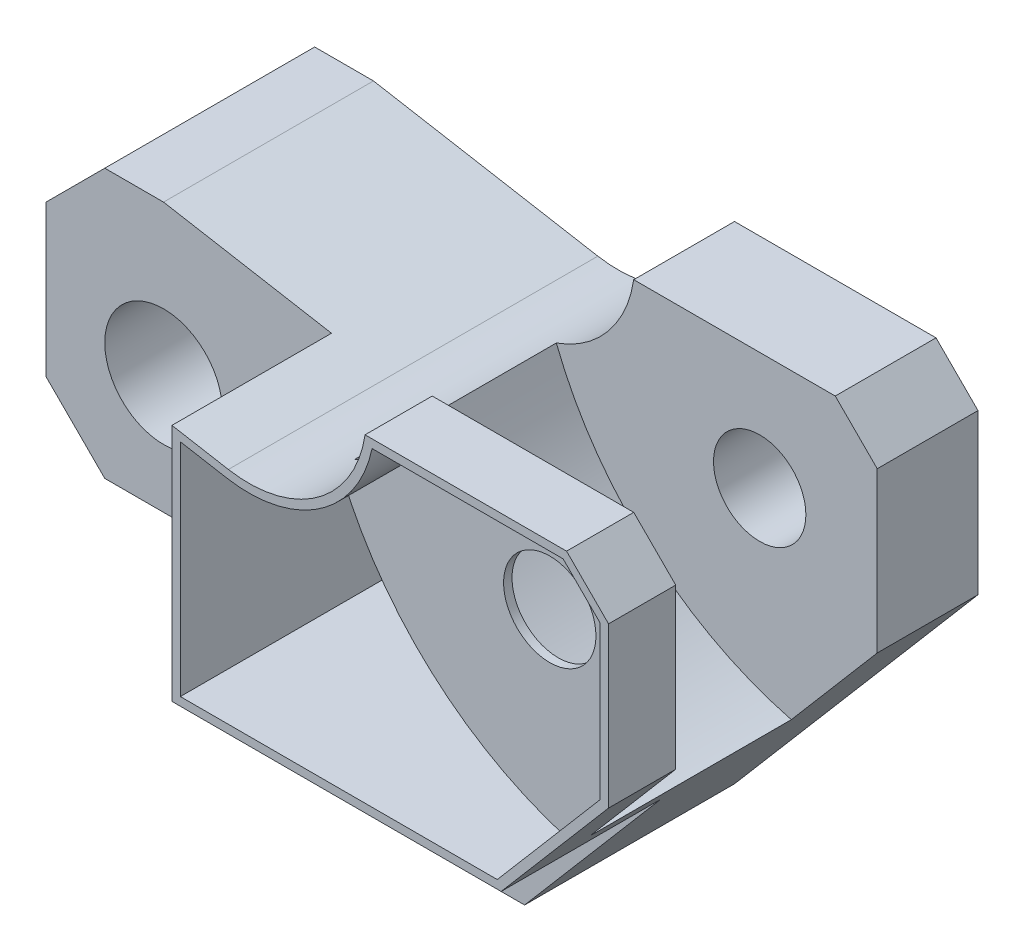
from build123d import *

# Parameters (mm, degrees)
SKETCH1_R           = 7
BOSS_EXTRUDE1_DEPTH = 44
SKETCH2_R           = 5.5
CUT_EXTRUDE1_DEPTH  = 99.636339936
CUT_EXTRUDE2_START  = -19
CUT_EXTRUDE2_DEPTH  = 19
CUT_EXTRUDE3_DEPTH  = 24
CUT_EXTRUDE4_DEPTH  = 7
CUT_EXTRUDE5_DEPTH  = 25


with BuildPart() as part:
    # Sketch1 → Boss-Extrude1 (new body)
    with BuildSketch(Plane.XY):
        with BuildLine():
            ThreePointArc((-40.404910175, -1.633500031), (-37.139674394, -2.846913799), (-35.459271434, -5.898205914))
            ThreePointArc((-35.459271434, -5.898205914), (-33.122441231, -13.749172092), (-28.683469034, -20.633500031))
            Line((-28.683469034, -20.633500031), (-22.980449087, -20.633500031))
            Line((-22.980449087, -20.633500031), (6.019550913, 13.366499969))
            Line((6.019550913, 13.366499969), (6.019550913, 32.366499969))
            Line((6.019550913, 32.366499969), (1.019550913, 37.366499969))
            Line((1.019550913, 37.366499969), (-22.980449087, 37.366499969))
            ThreePointArc((-22.980449087, 37.366499969), (-28.648710625, 28.077944899), (-39.256864445, 25.654410975))
            Line((-39.256864445, 25.654410975), (-65.980449087, 30.366499969))
            Line((-65.980449087, 30.366499969), (-72.980449087, 30.366499969))
            Line((-72.980449087, 30.366499969), (-79.980449087, 23.366499969))
            Line((-79.980449087, 23.366499969), (-79.980449087, 5.366499969))
            Line((-79.980449087, 5.366499969), (-72.980449087, -1.633500031))
            Line((-72.980449087, -1.633500031), (-40.404910175, -1.633500031))
        make_face()
        with Locations((-65.980449087, 12.366499969)):
            Circle(SKETCH1_R, mode=Mode.SUBTRACT)
    extrude(amount=BOSS_EXTRUDE1_DEPTH)

    # Sketch2 → Cut-Extrude1 (cut, through all)
    with BuildSketch(Plane.XY.offset(44)):
        with Locations((-7.980449087, 23.366499969)):
            Circle(SKETCH2_R)
    extrude(amount=-CUT_EXTRUDE1_DEPTH, mode=Mode.SUBTRACT)

    # Sketch3 → Cut-Extrude2 (cut)
    with BuildSketch(Plane.XY.offset(44).offset(CUT_EXTRUDE2_START)):
        Polygon((-45.980449087, 26.839960355), (-45.980449087, -1.633500031), (-72.980449087, -1.633500031), (-79.980449087, 5.366499969), (-79.980449087, 23.366499969), (-72.980449087, 30.366499969), (-65.980449087, 30.366499969), align=None)
        with BuildLine():
            Line((-40.404910175, -1.633500031), (-6.774566734, -1.633500031))
            Line((-6.774566734, -1.633500031), (-22.980449087, -20.633500031))
            Line((-22.980449087, -20.633500031), (-28.683469034, -20.633500031))
            ThreePointArc((-28.683469034, -20.633500031), (-33.122441231, -13.749172092), (-35.459271434, -5.898205914))
            ThreePointArc((-35.459271434, -5.898205914), (-37.139674394, -2.846913799), (-40.404910175, -1.633500031))
        make_face()
    extrude(amount=CUT_EXTRUDE2_DEPTH, mode=Mode.SUBTRACT)

    # Sketch7 → Cut-Extrude3 (cut)
    with BuildSketch(Plane(origin=(0, 0, 12), x_dir=(-1, 0, 0), z_dir=(0, 0, -1))):
        with BuildLine():
            Line((-6.019550913, 13.366499969), (4.215743204, 1.366499969))
            ThreePointArc((4.215743204, 1.366499969), (21.210918642, 10.417084234), (32.200340902, 26.227892629))
            ThreePointArc((32.200340902, 26.227892629), (26.041094158, 30.514775107), (22.980449087, 37.366499969))
            Line((22.980449087, 37.366499969), (-1.019550913, 37.366499969))
            Line((-1.019550913, 37.366499969), (-6.019550913, 32.366499969))
            Line((-6.019550913, 32.366499969), (-6.019550913, 13.366499969))
        make_face()
    extrude(amount=-CUT_EXTRUDE3_DEPTH, mode=Mode.SUBTRACT)

    # Sketch8 → Cut-Extrude4 (cut)
    with BuildSketch(Plane.XY.offset(44)):
        with BuildLine():
            Line((-44.980449087, 25.648206762), (-44.980449087, -0.633500031))
            Line((-44.980449087, -0.633500031), (-7.235972791, -0.633500031))
            Line((-7.235972791, -0.633500031), (5.019550913, 13.735045001))
            Line((5.019550913, 13.735045001), (5.019550913, 31.952286406))
            Line((5.019550913, 31.952286406), (0.605337351, 36.366499969))
            Line((0.605337351, 36.366499969), (-22.144406347, 36.366499969))
            ThreePointArc((-22.144406347, 36.366499969), (-28.419495692, 27.018587194), (-39.430512622, 24.669603222))
            Line((-39.430512622, 24.669603222), (-44.980449087, 25.648206762))
        make_face()
    extrude(amount=-CUT_EXTRUDE4_DEPTH, mode=Mode.SUBTRACT)

    # Sketch12 → Cut-Extrude5 (cut)
    with BuildSketch(Plane.XY.offset(37)):
        with BuildLine():
            Line((-7.235972791, -0.633500031), (-5.99360134, 0.823073394))
            ThreePointArc((-5.99360134, 0.823073394), (-22.117044704, 9.886135078), (-32.783766787, 24.996580242))
            ThreePointArc((-32.783766787, 24.996580242), (-36.088777964, 24.459836681), (-39.430512622, 24.669603222))
            Line((-39.430512622, 24.669603222), (-44.980449087, 25.648206762))
            Line((-44.980449087, 25.648206762), (-44.980449087, -0.633500031))
            Line((-44.980449087, -0.633500031), (-7.235972791, -0.633500031))
        make_face()
    extrude(amount=-CUT_EXTRUDE5_DEPTH, mode=Mode.SUBTRACT)


solid = part.part
